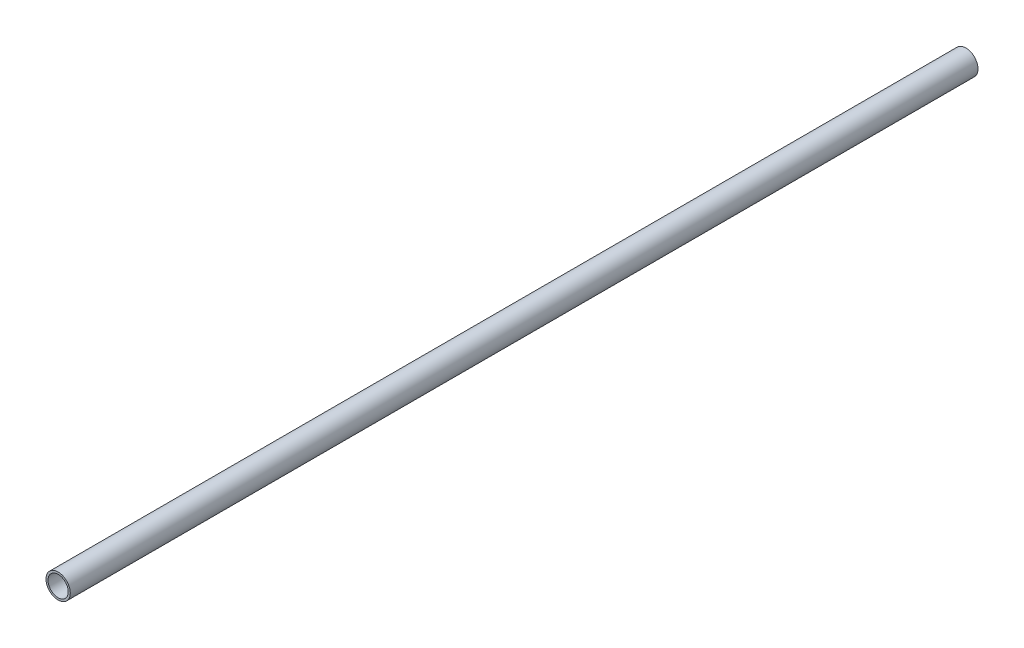
from build123d import *

# Parameters (mm, degrees)
IZIM1_R                     = 9
Y_KSEKLIK_EKSTR_ZYON1_DEPTH = 672.24
IZIM2_R                     = 7.5
KES_EKSTR_ZYON1_DEPTH       = 672.24


with BuildPart() as part:
    # Çizim1 → Yükseklik-Ekstrüzyon1 (new body)
    with BuildSketch(Plane.XY):
        Circle(IZIM1_R)
    extrude(amount=Y_KSEKLIK_EKSTR_ZYON1_DEPTH)

    # Çizim2 → Kes-Ekstrüzyon1 (cut)
    with BuildSketch(Plane(origin=(0, 0, 0), x_dir=(-1, 0, 0), z_dir=(0, 0, -1))):
        Circle(IZIM2_R)
    extrude(amount=-KES_EKSTR_ZYON1_DEPTH, mode=Mode.SUBTRACT)


solid = part.part
